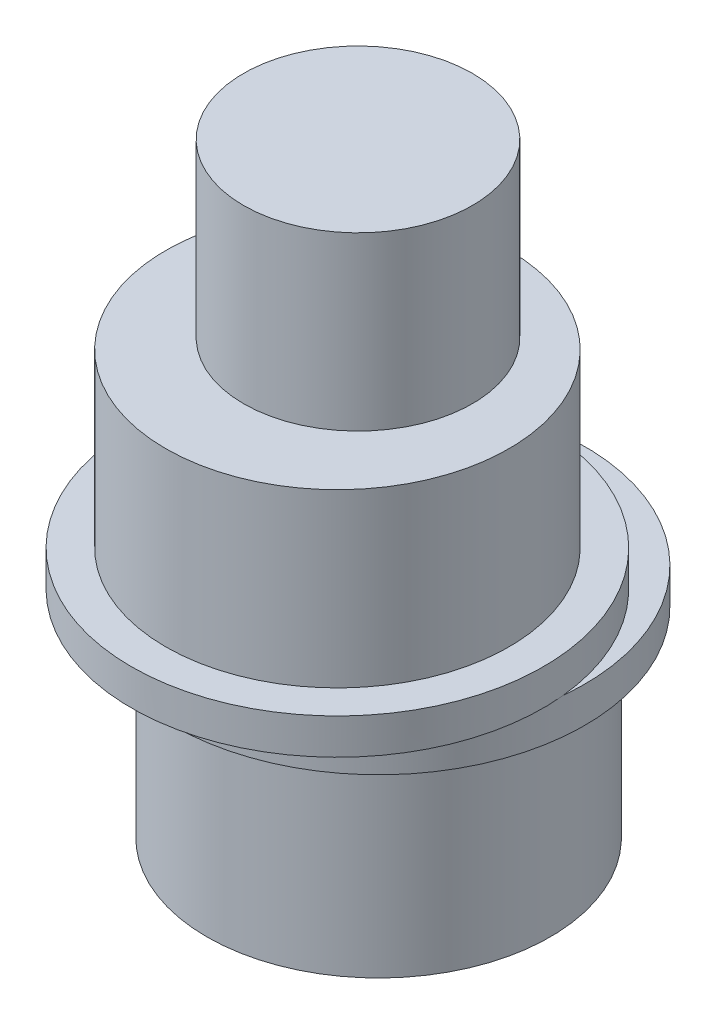
from build123d import *

# Parameters (mm, degrees)
SKETCH1_R               = 6
BOSS_EXTRUDE1_DEPTH     = 7
SKETCH2_R               = 7.2
BOSS_EXTRUDE2_DEPTH     = 1.25
SKETCH3_R               = 7.2
BOSS_EXTRUDE3_DEPTH     = 1.25
SKETCH4_R               = 6
BOSS_EXTRUDE4_DEPTH     = 6
CUT_EXTRUDE2_DEPTH      = 19.836570813
CUT_EXTRUDE2_DEPTH_BACK = 11
SKETCH6_R               = 4
BOSS_EXTRUDE5_DEPTH     = 6


with BuildPart() as part:
    # Sketch1 → Boss-Extrude1 (new body)
    with BuildSketch(Plane(origin=(0, 0, 0), x_dir=(1, 0, 0), z_dir=(0, 1, 0))):
        with Locations(Location((0, 0.72, 0), (0, 0, 270))):
            Circle(SKETCH1_R)
    extrude(amount=BOSS_EXTRUDE1_DEPTH)

    # Sketch2 → Boss-Extrude2 (add)
    with BuildSketch(Plane(origin=(0, 7, 0), x_dir=(1, 0, 0), z_dir=(0, 1, 0))):
        with Locations(Location((0, 0.72, 0), (0, 0, 270))):
            Circle(SKETCH2_R)
    extrude(amount=BOSS_EXTRUDE2_DEPTH)

    # Sketch3 → Boss-Extrude3 (add)
    with BuildSketch(Plane(origin=(0, 8.25, 0), x_dir=(1, 0, 0), z_dir=(0, 1, 0))):
        with Locations(Location((0, -0.72, 0), (0, 0, 174.260829523))):
            Circle(SKETCH3_R)
    extrude(amount=BOSS_EXTRUDE3_DEPTH)

    # Sketch4 → Boss-Extrude4 (add)
    with BuildSketch(Plane(origin=(0, 9.5, 0), x_dir=(1, 0, 0), z_dir=(0, 1, 0))):
        with Locations(Location((0, -0.72, 0), (0, 0, 270))):
            Circle(SKETCH4_R)
    extrude(amount=BOSS_EXTRUDE4_DEPTH)

    # Sketch5 → Cut-Extrude2 (cut, two sides: drawn at the far end of the back side and taken through both)
    with BuildSketch(Plane.XZ.offset(-CUT_EXTRUDE2_DEPTH_BACK)):
        with BuildLine():
            Line((1.490176164, 2.1), (-1.490176164, 2.1))
            ThreePointArc((-1.490176164, 2.1), (0, -2.575), (1.490176164, 2.1))
        make_face()
    extrude(amount=CUT_EXTRUDE2_DEPTH + CUT_EXTRUDE2_DEPTH_BACK, mode=Mode.SUBTRACT)

    # Sketch6 → Boss-Extrude5 (add)
    with BuildSketch(Plane(origin=(0, 15.5, 0), x_dir=(1, 0, 0), z_dir=(0, 1, 0))):
        with Locations(Location((0, 0, 0), (0, 0, 270))):
            Circle(SKETCH6_R)
    extrude(amount=BOSS_EXTRUDE5_DEPTH)


solid = part.part
